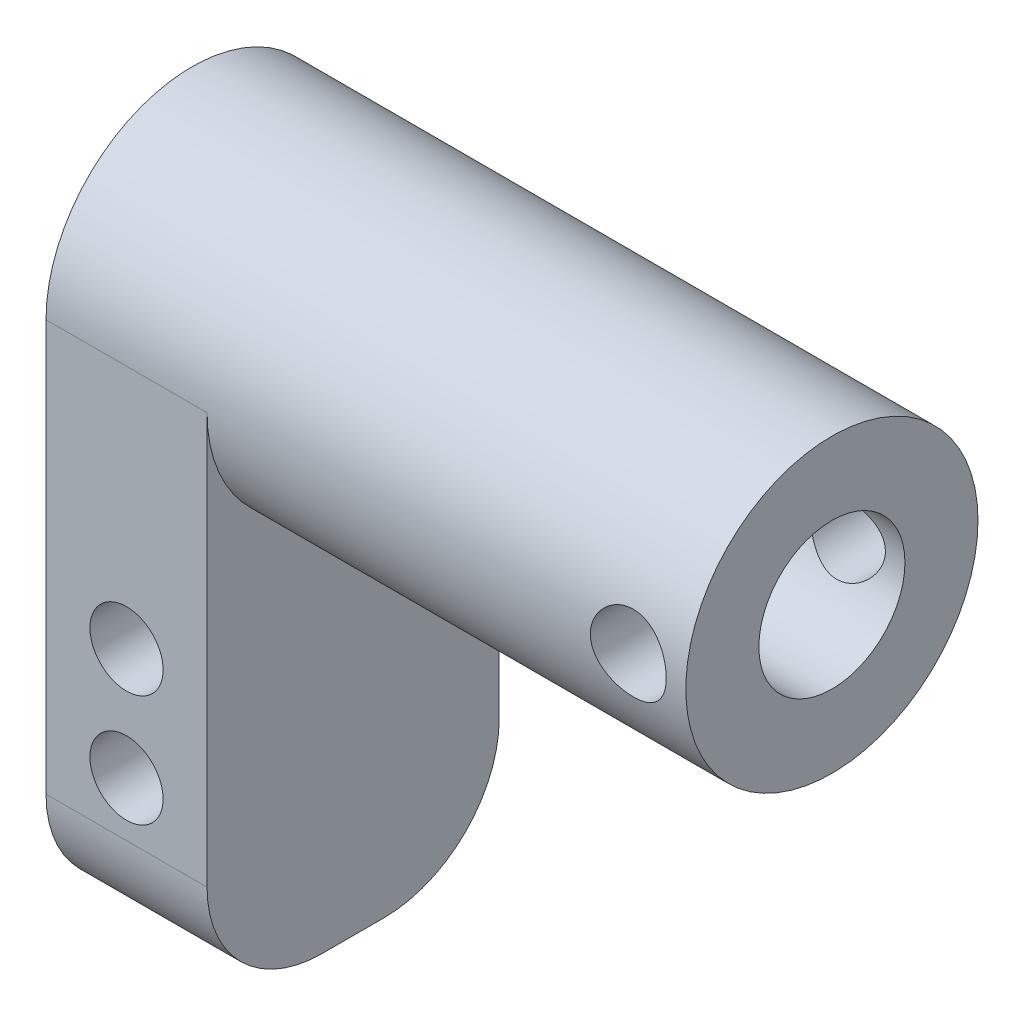
from build123d import *

# Parameters (mm, degrees)
SKETCH1_R             = 6.35
SKETCH1_R_2           = 3.175
BOSS_EXTRUDE1_DEPTH   = 27.81
SKETCH1_3_R           = 3.175
SKETCH1_3_R_2         = 3
BOSS_EXTRUDE2_DEPTH   = 7
M4X0_7_TAPPED_HOLE1_D = 3.3
BOSS_EXTRUDE3_DEPTH   = 7
FILLET2_R             = 5
SKETCH11_R            = 1.59
CUT_EXTRUDE5_DEPTH    = 39.174149737
CUT_EXTRUDE6_DEPTH    = 15


with BuildPart() as part:
    # Sketch1 → Boss-Extrude1 (new body)
    with BuildSketch(Plane.YZ):
        Circle(SKETCH1_R)
        Circle(SKETCH1_R_2, mode=Mode.SUBTRACT)
    extrude(amount=BOSS_EXTRUDE1_DEPTH)

    # Sketch1<3> → Boss-Extrude2 (add)
    with BuildSketch(Plane.YZ):
        Circle(SKETCH1_3_R)
        Circle(SKETCH1_3_R_2, mode=Mode.SUBTRACT)
    extrude(amount=BOSS_EXTRUDE2_DEPTH)

    # M4x0.7 Tapped Hole1 (through all)
    with Locations(Plane(origin=(0, 0, 6.35), x_dir=(0, 1, 0), z_dir=(0, 0, 1))):
        with Locations((0, -25.31)):
            Hole(M4X0_7_TAPPED_HOLE1_D / 2)

    # Sketch10 → Boss-Extrude3 (add)
    with BuildSketch(Plane(origin=(0, 0, 0), x_dir=(0, -1, 0), z_dir=(-1, 0, 0))):
        with BuildLine():
            Line((22.86, 6.35), (0, 6.35))
            ThreePointArc((0, 6.35), (6.35, 0), (0, -6.35))
            Line((0, -6.35), (22.86, -6.35))
            Line((22.86, -6.35), (22.86, 6.35))
        make_face()
    extrude(amount=-BOSS_EXTRUDE3_DEPTH)

    # Fillet2
    fillet2_edges = [part.edges().sort_by_distance(p)[0] for p in [
        (3.5, -22.86, 6.35),
        (3.5, -22.86, -6.35),
    ]]
    fillet(fillet2_edges, radius=FILLET2_R)

    # Sketch11 → Cut-Extrude5 (cut, through all)
    with BuildSketch(Plane(origin=(0, 0, -6.35), x_dir=(1, 0, 0), z_dir=(0, 0, -1))):
        with Locations((3.5, 15.5)):
            Circle(SKETCH11_R)
        with Locations((3.5, 10.64)):
            Circle(SKETCH11_R)
    extrude(amount=-CUT_EXTRUDE5_DEPTH, mode=Mode.SUBTRACT)

    # Sketch14 → Cut-Extrude6 (cut)
    with BuildSketch(Plane.ZY):
        with BuildLine():
            Line((0.394195268, -3.844294872), (0.511152831, -3.259062998))
            ThreePointArc((0.511152831, -3.259062998), (0.551737931, -3.219580053), (0.603153546, -3.243296878))
            Line((0.603153546, -3.243296878), (0.90829688, -3.756193519))
            ThreePointArc((0.90829688, -3.756193519), (0.932155167, -3.776831916), (0.963621249, -3.779078471))
            ThreePointArc((0.963621249, -3.779078471), (1.132224679, -3.732032593), (1.298547251, -3.677468564))
            Line((1.298547251, -3.677468564), (1.333878559, -3.664801221))
            ThreePointArc((1.333878559, -3.664801221), (1.496981223, -3.601256339), (1.65706823, -3.530456752))
            ThreePointArc((1.65706823, -3.530456752), (1.679938755, -3.50872888), (1.685248668, -3.477632801))
            Line((1.685248668, -3.477632801), (1.594991737, -2.887692885))
            ThreePointArc((1.594991737, -2.887692885), (1.619625293, -2.836710131), (1.676051799, -2.841411481))
            Line((1.676051799, -2.841411481), (2.138213721, -3.219011503))
            ThreePointArc((2.138213721, -3.219011503), (2.167691925, -3.230245238), (2.198028737, -3.221594275))
            ThreePointArc((2.198028737, -3.221594275), (2.340373498, -3.119719841), (2.478003595, -3.011560756))
            Line((2.478003595, -3.011560756), (2.506871678, -2.987573328))
            ThreePointArc((2.506871678, -2.987573328), (2.638404418, -2.872076274), (2.764622113, -2.750793444))
            ThreePointArc((2.764622113, -2.750793444), (2.778682006, -2.722553743), (2.773036206, -2.69151689))
            Line((2.773036206, -2.69151689), (2.4864511, -2.168024393))
            ThreePointArc((2.4864511, -2.168024393), (2.492161942, -2.111691103), (2.54679347, -2.096809925))
            Line((2.54679347, -2.096809925), (3.110230431, -2.293569192))
            ThreePointArc((3.110230431, -2.293569192), (3.141773045, -2.29404331), (3.16732152, -2.275538263))
            ThreePointArc((3.16732152, -2.275538263), (3.266238734, -2.131122834), (3.358576134, -1.982414274))
            Line((3.358576134, -1.982414274), (3.377499075, -1.95))
            ThreePointArc((3.377499075, -1.95), (3.461597101, -1.796481424), (3.538721767, -1.63934385))
            ThreePointArc((3.538721767, -1.63934385), (3.542275198, -1.607998444), (3.526354653, -1.58076432))
            Line((3.526354653, -1.58076432), (3.078007764, -1.186860162))
            ThreePointArc((3.078007764, -1.186860162), (3.06410708, -1.131970962), (3.110354261, -1.099302146))
            Line((3.110354261, -1.099302146), (3.707107449, -1.091488587))
            ThreePointArc((3.707107449, -1.091488587), (3.736909969, -1.081145903), (3.754588583, -1.055018754))
            ThreePointArc((3.754588583, -1.055018754), (3.798147373, -0.885480962), (3.834054823, -0.714159374))
            Line((3.834054823, -0.714159374), (3.840750237, -0.677227893))
            ThreePointArc((3.840750237, -0.677227893), (3.867270087, -0.504204401), (3.88599935, -0.330165193))
            ThreePointArc((3.88599935, -0.330165193), (3.878617723, -0.299494801), (3.854342685, -0.279348243))
            Line((3.854342685, -0.279348243), (3.298311265, -0.062543079))
            ThreePointArc((3.298311265, -0.062543079), (3.266475683, -0.015718417), (3.298760425, 0.030797696))
            Line((3.298760425, 0.030797696), (3.856852597, 0.24224165))
            ThreePointArc((3.856852597, 0.24224165), (3.881320399, 0.262153656), (3.888996851, 0.292751587))
            ThreePointArc((3.888996851, 0.292751587), (3.871943384, 0.466962983), (3.847089917, 0.640233686))
            Line((3.847089917, 0.640233686), (3.840750237, 0.677227893))
            ThreePointArc((3.840750237, 0.677227893), (3.806493224, 0.848887114), (3.76456806, 1.018836259))
            ThreePointArc((3.76456806, 1.018836259), (3.747141708, 1.045132335), (3.717440105, 1.055761355))
            Line((3.717440105, 1.055761355), (3.12078975, 1.069317621))
            ThreePointArc((3.12078975, 1.069317621), (3.074859111, 1.102430001), (3.089287397, 1.157182881))
            Line((3.089287397, 1.157182881), (3.541404401, 1.546753969))
            ThreePointArc((3.541404401, 1.546753969), (3.557586307, 1.573833615), (3.554334703, 1.605211767))
            ThreePointArc((3.554334703, 1.605211767), (3.47872588, 1.763084301), (3.396109189, 1.917405115))
            Line((3.396109189, 1.917405115), (3.377499075, 1.95))
            ThreePointArc((3.377499075, 1.95), (3.286597101, 2.099590315), (3.189074303, 2.244951022))
            ThreePointArc((3.189074303, 2.244951022), (3.163705101, 2.263701087), (3.132159385, 2.263530552))
            Line((3.132159385, 2.263530552), (2.566854933, 2.072202836))
            ThreePointArc((2.566854933, 2.072202836), (2.51236915, 2.087609091), (2.507200715, 2.143994732))
            Line((2.507200715, 2.143994732), (2.798810569, 2.664704931))
            ThreePointArc((2.798810569, 2.664704931), (2.804754802, 2.695686013), (2.790967334, 2.724059717))
            ThreePointArc((2.790967334, 2.724059717), (2.665922694, 2.846551631), (2.535507572, 2.963309189))
            Line((2.535507572, 2.963309189), (2.506871678, 2.987573328))
            ThreePointArc((2.506871678, 2.987573328), (2.370288863, 3.097051938), (2.228931119, 3.200291559))
            ThreePointArc((2.228931119, 3.200291559), (2.198678968, 3.209234079), (2.169094017, 3.198284558))
            Line((2.169094017, 3.198284558), (1.703319528, 2.825149805))
            ThreePointArc((1.703319528, 2.825149805), (1.64685039, 2.820991714), (1.622708626, 2.872209177))
            Line((1.622708626, 2.872209177), (1.718638876, 3.461253152))
            ThreePointArc((1.718638876, 3.461253152), (1.713628474, 3.492398894), (1.690968114, 3.514345862))
            ThreePointArc((1.690968114, 3.514345862), (1.531569886, 3.586682825), (1.369086322, 3.651794441))
            Line((1.369086322, 3.651794441), (1.333878559, 3.664801221))
            ThreePointArc((1.333878559, 3.664801221), (1.168088806, 3.720963389), (0.999945947, 3.769629704))
            ThreePointArc((0.999945947, 3.769629704), (0.968459702, 3.767686078), (0.944403898, 3.747278245))
            Line((0.944403898, 3.747278245), (0.63433865, 3.237342014))
            ThreePointArc((0.63433865, 3.237342014), (0.582697169, 3.214121104), (0.542493927, 3.253992805))
            Line((0.542493927, 3.253992805), (0.43117397, 3.840323161))
            ThreePointArc((0.43117397, 3.840323161), (0.415813261, 3.867876925), (0.387013183, 3.88075003))
            ThreePointArc((0.387013183, 3.88075003), (0.212487146, 3.894207135), (0.037533056, 3.899819389))
            Line((0.037533056, 3.899819389), (0, 3.9))
            ThreePointArc((0, 3.9), (-0.175, 3.89607174), (-0.349647464, 3.884294872))
            ThreePointArc((-0.349647464, 3.884294872), (-0.378570097, 3.871699531), (-0.394195268, 3.844294872))
            Line((-0.394195268, 3.844294872), (-0.511152831, 3.259062998))
            ThreePointArc((-0.511152831, 3.259062998), (-0.551737931, 3.219580053), (-0.603153546, 3.243296878))
            Line((-0.603153546, 3.243296878), (-0.90829688, 3.756193519))
            ThreePointArc((-0.90829688, 3.756193519), (-0.932155167, 3.776831916), (-0.963621249, 3.779078471))
            ThreePointArc((-0.963621249, 3.779078471), (-1.132224679, 3.732032593), (-1.298547251, 3.677468564))
            Line((-1.298547251, 3.677468564), (-1.333878559, 3.664801221))
            ThreePointArc((-1.333878559, 3.664801221), (-1.496981223, 3.601256339), (-1.65706823, 3.530456752))
            ThreePointArc((-1.65706823, 3.530456752), (-1.679938755, 3.50872888), (-1.685248668, 3.477632801))
            Line((-1.685248668, 3.477632801), (-1.594991737, 2.887692885))
            ThreePointArc((-1.594991737, 2.887692885), (-1.619625293, 2.836710131), (-1.676051799, 2.841411481))
            Line((-1.676051799, 2.841411481), (-2.138213721, 3.219011503))
            ThreePointArc((-2.138213721, 3.219011503), (-2.167691925, 3.230245238), (-2.198028737, 3.221594275))
            ThreePointArc((-2.198028737, 3.221594275), (-2.340373498, 3.119719841), (-2.478003595, 3.011560756))
            Line((-2.478003595, 3.011560756), (-2.506871678, 2.987573328))
            ThreePointArc((-2.506871678, 2.987573328), (-2.638404418, 2.872076274), (-2.764622113, 2.750793444))
            ThreePointArc((-2.764622113, 2.750793444), (-2.778682006, 2.722553743), (-2.773036206, 2.69151689))
            Line((-2.773036206, 2.69151689), (-2.4864511, 2.168024393))
            ThreePointArc((-2.4864511, 2.168024393), (-2.492161942, 2.111691103), (-2.54679347, 2.096809925))
            Line((-2.54679347, 2.096809925), (-3.110230431, 2.293569192))
            ThreePointArc((-3.110230431, 2.293569192), (-3.141773045, 2.29404331), (-3.16732152, 2.275538263))
            ThreePointArc((-3.16732152, 2.275538263), (-3.266238734, 2.131122834), (-3.358576134, 1.982414274))
            Line((-3.358576134, 1.982414274), (-3.377499075, 1.95))
            ThreePointArc((-3.377499075, 1.95), (-3.461597101, 1.796481424), (-3.538721767, 1.63934385))
            ThreePointArc((-3.538721767, 1.63934385), (-3.542275198, 1.607998444), (-3.526354653, 1.58076432))
            Line((-3.526354653, 1.58076432), (-3.078007764, 1.186860162))
            ThreePointArc((-3.078007764, 1.186860162), (-3.06410708, 1.131970962), (-3.110354261, 1.099302146))
            Line((-3.110354261, 1.099302146), (-3.707107449, 1.091488587))
            ThreePointArc((-3.707107449, 1.091488587), (-3.736909969, 1.081145903), (-3.754588583, 1.055018754))
            ThreePointArc((-3.754588583, 1.055018754), (-3.798147373, 0.885480962), (-3.834054823, 0.714159374))
            Line((-3.834054823, 0.714159374), (-3.840750237, 0.677227893))
            ThreePointArc((-3.840750237, 0.677227893), (-3.867270087, 0.504204401), (-3.88599935, 0.330165193))
            ThreePointArc((-3.88599935, 0.330165193), (-3.878617723, 0.299494801), (-3.854342685, 0.279348243))
            Line((-3.854342685, 0.279348243), (-3.298311265, 0.062543079))
            ThreePointArc((-3.298311265, 0.062543079), (-3.266475683, 0.015718417), (-3.298760425, -0.030797696))
            Line((-3.298760425, -0.030797696), (-3.856852597, -0.24224165))
            ThreePointArc((-3.856852597, -0.24224165), (-3.881320399, -0.262153656), (-3.888996851, -0.292751587))
            ThreePointArc((-3.888996851, -0.292751587), (-3.871943384, -0.466962983), (-3.847089917, -0.640233686))
            Line((-3.847089917, -0.640233686), (-3.840750237, -0.677227893))
            ThreePointArc((-3.840750237, -0.677227893), (-3.806493224, -0.848887114), (-3.76456806, -1.018836259))
            ThreePointArc((-3.76456806, -1.018836259), (-3.747141708, -1.045132335), (-3.717440105, -1.055761355))
            Line((-3.717440105, -1.055761355), (-3.12078975, -1.069317621))
            ThreePointArc((-3.12078975, -1.069317621), (-3.074859111, -1.102430001), (-3.089287397, -1.157182881))
            Line((-3.089287397, -1.157182881), (-3.541404401, -1.546753969))
            ThreePointArc((-3.541404401, -1.546753969), (-3.557586307, -1.573833615), (-3.554334703, -1.605211767))
            ThreePointArc((-3.554334703, -1.605211767), (-3.47872588, -1.763084301), (-3.396109189, -1.917405115))
            Line((-3.396109189, -1.917405115), (-3.377499075, -1.95))
            ThreePointArc((-3.377499075, -1.95), (-3.286597101, -2.099590315), (-3.189074303, -2.244951022))
            ThreePointArc((-3.189074303, -2.244951022), (-3.163705101, -2.263701087), (-3.132159385, -2.263530552))
            Line((-3.132159385, -2.263530552), (-2.566854933, -2.072202836))
            ThreePointArc((-2.566854933, -2.072202836), (-2.51236915, -2.087609091), (-2.507200715, -2.143994732))
            Line((-2.507200715, -2.143994732), (-2.798810569, -2.664704931))
            ThreePointArc((-2.798810569, -2.664704931), (-2.804754802, -2.695686013), (-2.790967334, -2.724059717))
            ThreePointArc((-2.790967334, -2.724059717), (-2.665922694, -2.846551631), (-2.535507572, -2.963309189))
            Line((-2.535507572, -2.963309189), (-2.506871678, -2.987573328))
            ThreePointArc((-2.506871678, -2.987573328), (-2.370288863, -3.097051938), (-2.228931119, -3.200291559))
            ThreePointArc((-2.228931119, -3.200291559), (-2.198678968, -3.209234079), (-2.169094017, -3.198284558))
            Line((-2.169094017, -3.198284558), (-1.703319528, -2.825149805))
            ThreePointArc((-1.703319528, -2.825149805), (-1.64685039, -2.820991714), (-1.622708626, -2.872209177))
            Line((-1.622708626, -2.872209177), (-1.718638876, -3.461253152))
            ThreePointArc((-1.718638876, -3.461253152), (-1.713628474, -3.492398894), (-1.690968114, -3.514345862))
            ThreePointArc((-1.690968114, -3.514345862), (-1.531569886, -3.586682825), (-1.369086322, -3.651794441))
            Line((-1.369086322, -3.651794441), (-1.333878559, -3.664801221))
            ThreePointArc((-1.333878559, -3.664801221), (-1.168088806, -3.720963389), (-0.999945947, -3.769629704))
            ThreePointArc((-0.999945947, -3.769629704), (-0.968459702, -3.767686078), (-0.944403898, -3.747278245))
            Line((-0.944403898, -3.747278245), (-0.63433865, -3.237342014))
            ThreePointArc((-0.63433865, -3.237342014), (-0.582697169, -3.214121104), (-0.542493927, -3.253992805))
            Line((-0.542493927, -3.253992805), (-0.43117397, -3.840323161))
            ThreePointArc((-0.43117397, -3.840323161), (-0.415813261, -3.867876925), (-0.387013183, -3.88075003))
            ThreePointArc((-0.387013183, -3.88075003), (-0.212487146, -3.894207135), (-0.037533056, -3.899819389))
            Line((-0.037533056, -3.899819389), (0, -3.9))
            ThreePointArc((0, -3.9), (0.175, -3.89607174), (0.349647464, -3.884294872))
            ThreePointArc((0.349647464, -3.884294872), (0.378570097, -3.871699531), (0.394195268, -3.844294872))
        make_face()
    extrude(amount=-CUT_EXTRUDE6_DEPTH, mode=Mode.SUBTRACT)


solid = part.part
